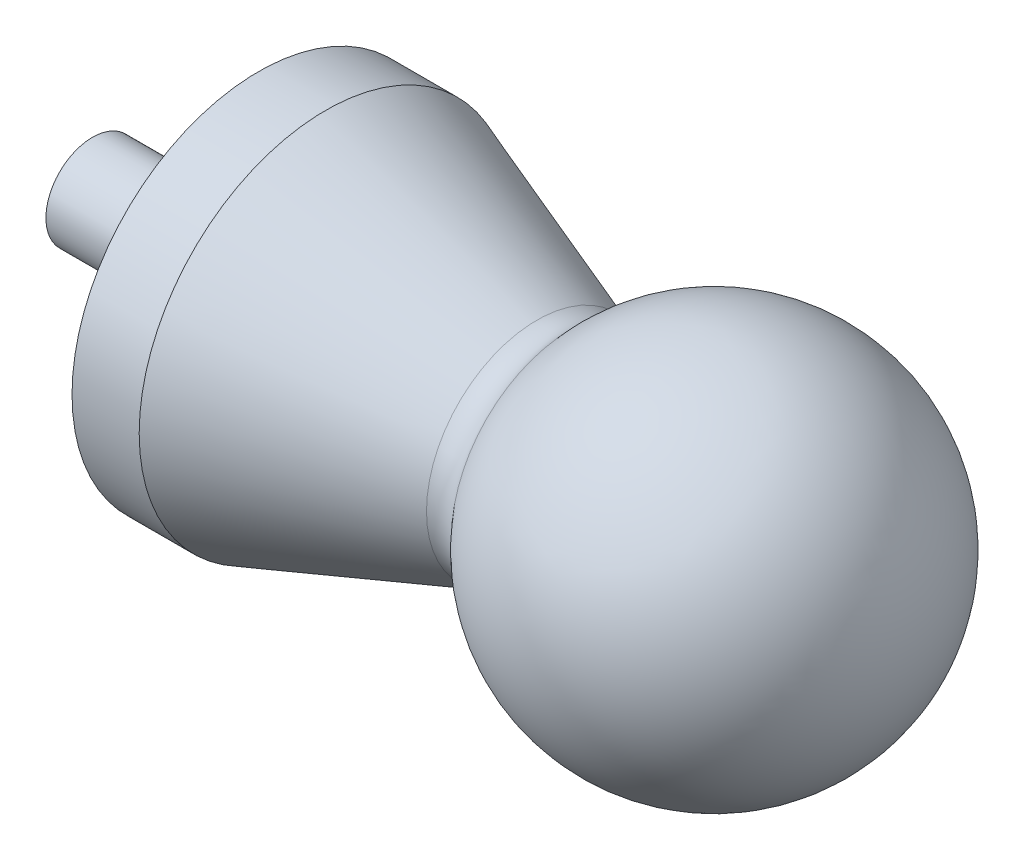
from build123d import *

# Parameters (mm, degrees)
FILLET1_R = 2


with BuildPart() as part:
    # Sketch1 → Revolve1 (revolve)
    with BuildSketch(Plane(origin=(0, 0, 0), x_dir=(1, 0, 0), z_dir=(0, 1, 0))):
        with BuildLine():
            Line((-25, 12), (-10.017761944, 6.6063943))
            ThreePointArc((-10.017761944, 6.6063943), (3.448685016, 11.493762294), (12, 0))
            Line((12, 0), (-40, 0))
            Line((-40, 0), (-40, 3))
            Line((-40, 3), (-29.32, 3))
            Line((-29.32, 3), (-29.32, 12))
            Line((-29.32, 12), (-25, 12))
        make_face()
    revolve(axis=Axis((25.002810952, 0, 0), (-1, 0, 0)))

    # Fillet1
    fillet1_edges = [part.edges().sort_by_distance(p)[0] for p in [
        (-10.017761944, 0, 6.6063943),
    ]]
    fillet(fillet1_edges, radius=FILLET1_R)


solid = part.part
